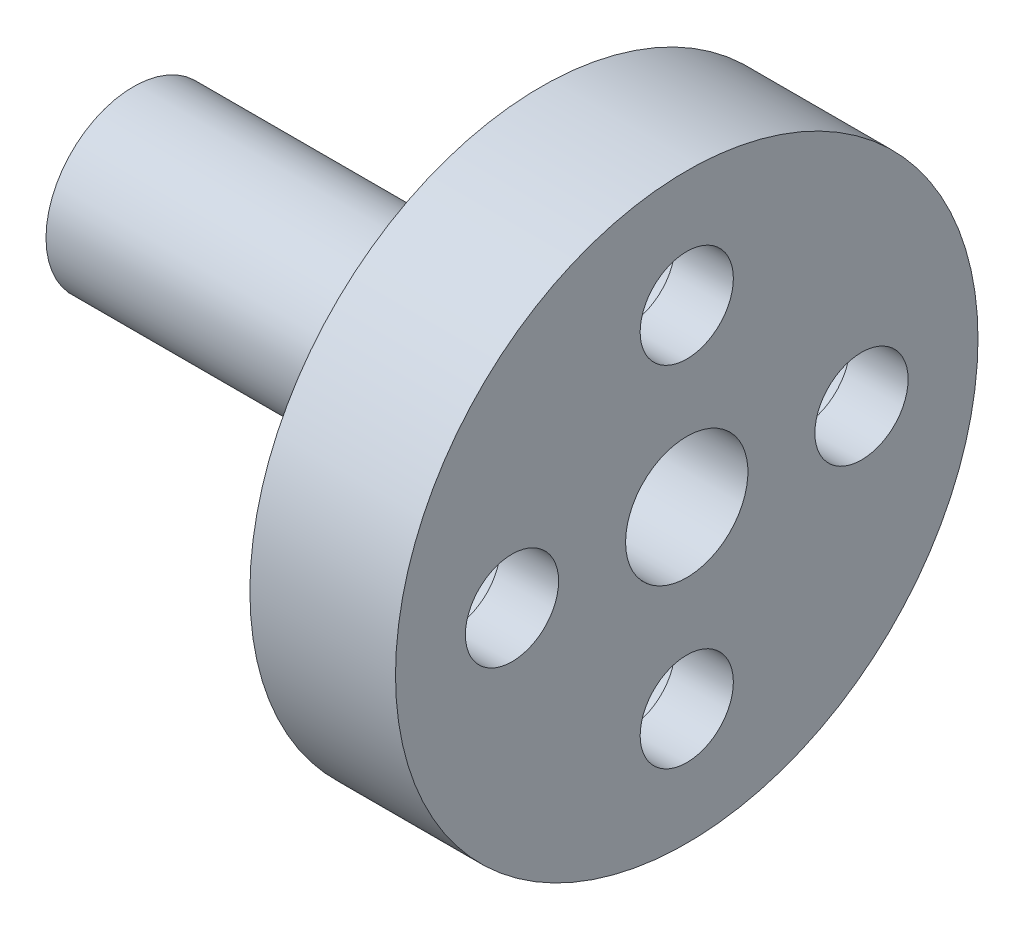
from build123d import *

# Parameters (mm, degrees)
CUT_EXTRUDE1_DEPTH      = 24.685438565
CUT_EXTRUDE1_DEPTH_BACK = 24.685438565
SKETCH2_R               = 1.6
SKETCH3_R               = 2.85
CUT_EXTRUDE2_DEPTH      = 3


with BuildPart() as part:
    # Sketch1 → Revolve1 (revolve)
    with BuildSketch(Plane.XY, mode=Mode.PRIVATE) as revolve1_sk:
        Polygon((0, 2.1), (0, 10), (-5, 10), (-5, 3), (-19, 3), (-19, 0), (-13, 0), (-13, 2.1), align=None)
    revolve(revolve1_sk.sketch.rotate(Axis((-10, 0, 0), (1, 0, 0)), 90), axis=Axis((-10, 0, 0), (1, 0, 0)))

    # Sketch2 → Cut-Extrude1 (cut, two sides: drawn at the far end of the back side and taken through both)
    with BuildSketch(Plane(origin=(0, 0, 0), x_dir=(0, 0, -1), z_dir=(1, 0, 0)).offset(-CUT_EXTRUDE1_DEPTH_BACK)):
        with Locations((-6, 0)):
            Circle(SKETCH2_R)
        with Locations((6, 0)):
            Circle(SKETCH2_R)
        with Locations((0, 6)):
            Circle(SKETCH2_R)
        with Locations((0, -6)):
            Circle(SKETCH2_R)
    extrude(amount=CUT_EXTRUDE1_DEPTH + CUT_EXTRUDE1_DEPTH_BACK, mode=Mode.SUBTRACT)

    # Sketch3 → Cut-Extrude2 (cut)
    with BuildSketch(Plane(origin=(-5, 0, 0), x_dir=(0, 0, -1), z_dir=(1, 0, 0))):
        with Locations((-6, 0)):
            Circle(SKETCH3_R)
        with Locations((6, 0)):
            Circle(SKETCH3_R)
        with Locations((0, 6)):
            Circle(SKETCH3_R)
        with Locations((0, -6)):
            Circle(SKETCH3_R)
    extrude(amount=CUT_EXTRUDE2_DEPTH, mode=Mode.SUBTRACT)


solid = part.part
